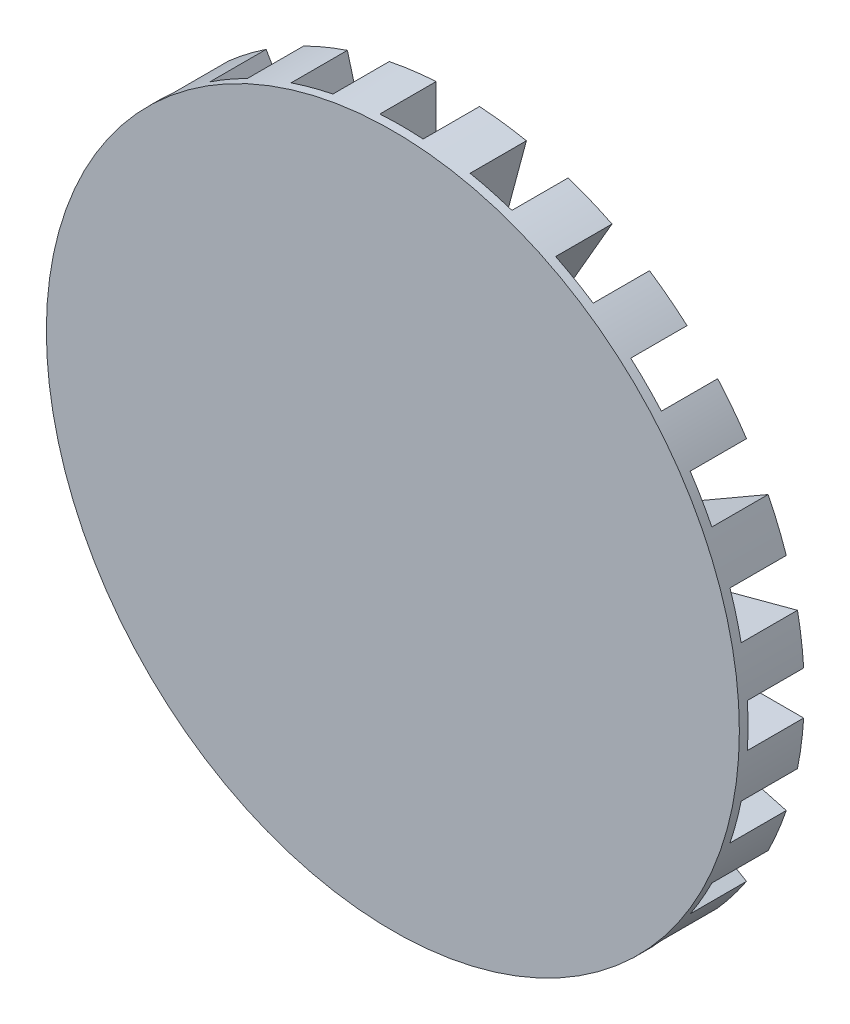
from build123d import *

# Parameters (mm, degrees)
BOSS_EXTRUDE1_START = 13
SKETCH1_R           = 80
BOSS_EXTRUDE1_DEPTH = 2
BOSS_EXTRUDE2_START = -15
BOSS_EXTRUDE2_DEPTH = 15
CIRPATTERN1_COUNT   = 24


with BuildPart() as part:
    # Sketch1 → Boss-Extrude1 (new body)
    with BuildSketch(Plane.XY.offset(BOSS_EXTRUDE1_START)):
        Circle(SKETCH1_R)
    extrude(amount=BOSS_EXTRUDE1_DEPTH)

    # Sketch3 → Boss-Extrude2 (add)
    with BuildSketch(Plane.XY.offset(15).offset(BOSS_EXTRUDE2_START)):
        with BuildLine():
            Line((-5, -79.843597113), (-5, -37.978770564))
            Line((-5, -37.978770564), (-15.835414431, -78.417087741))
            ThreePointArc((-15.835414431, -78.417087741), (-10.442095378, -79.31558891), (-5, -79.843597113))
        make_face()
    boss_extrude2 = extrude(amount=BOSS_EXTRUDE2_DEPTH)

    # CirPattern1: Boss-Extrude2 ×24 about axis
    cirpattern1_axis = Axis((0, 0, 0), (0, 0, 1))
    for i in range(1, CIRPATTERN1_COUNT):
        add(boss_extrude2.rotate(cirpattern1_axis, i * 360 / CIRPATTERN1_COUNT))


solid = part.part
